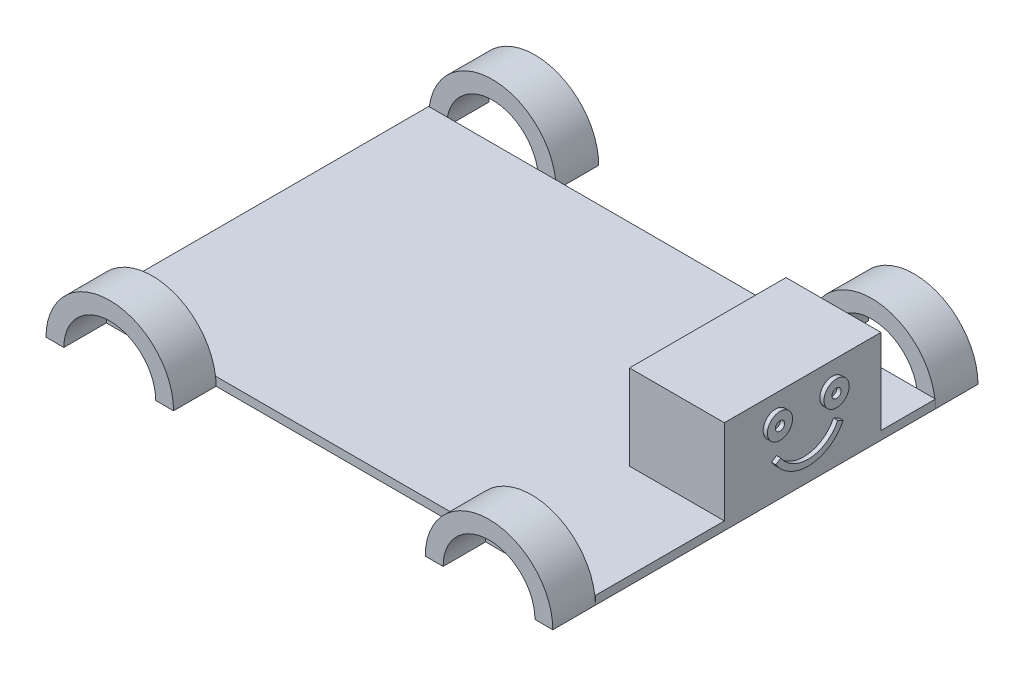
from build123d import *

# Parameters (mm, degrees)
BOSS_EXTRUDE1_DEPTH  = 50
SKETCH2_W            = 150
SKETCH2_H            = 10
BOSS_EXTRUDE2_DEPTH  = 400
SKETCH3_W            = 400
SKETCH3_H            = 10
BOSS_EXTRUDE3_DEPTH  = 446
MIRROR2_COPY_1_DEPTH = 50
SKETCH4_W            = 111.615994823
SKETCH4_H            = 184.082968076
BOSS_EXTRUDE4_DEPTH  = 100
SKETCH5_R            = 14.792808223
SKETCH5_R_2          = 5.397690937
BOSS_EXTRUDE5_DEPTH  = 5


with BuildPart() as part:
    # Sketch1 → Boss-Extrude1 (new body)
    with BuildSketch(Plane.XY):
        with BuildLine():
            ThreePointArc((-54, 0), (0, 54), (54, 0))
            Line((54, 0), (75, 0))
            ThreePointArc((75, 0), (0, 75), (-75, 0))
            Line((-75, 0), (-54, 0))
        make_face()
    boss_extrude1 = extrude(amount=BOSS_EXTRUDE1_DEPTH)

    # Sketch2 → Boss-Extrude2 (add)
    with BuildSketch(Plane(origin=(0, 0, 0), x_dir=(-1, 0, 0), z_dir=(0, 0, -1))):
        with Locations((0, 5)):
            Rectangle(SKETCH2_W, SKETCH2_H)
    extrude(amount=BOSS_EXTRUDE2_DEPTH)

    # Mirror1: Boss-Extrude1 across plane
    add(boss_extrude1.mirror(Plane(origin=(0, 0, -200), x_dir=(1, 0, 0), z_dir=(0, 0, -1))))

    # Sketch3 → Boss-Extrude3 (add)
    with BuildSketch(Plane(origin=(75, 0, 0), x_dir=(0, 0, -1), z_dir=(1, 0, 0))):
        with Locations((200, 5)):
            Rectangle(SKETCH3_W, SKETCH3_H)
    extrude(amount=BOSS_EXTRUDE3_DEPTH)

    # Mirror2: Boss-Extrude1 across plane
    add(boss_extrude1.mirror(Plane.ZY.offset(-223)))

    # Mirror2 copy 1 sketch → Mirror2 copy 1 (add)
    with BuildSketch(Plane(origin=(446, 0, -400), x_dir=(-1, 0, 0), z_dir=(0, 0, -1))):
        with BuildLine():
            ThreePointArc((-54, 0), (0, 54), (54, 0))
            Line((54, 0), (75, 0))
            ThreePointArc((75, 0), (0, 75), (-75, 0))
            Line((-75, 0), (-54, 0))
        make_face()
    extrude(amount=MIRROR2_COPY_1_DEPTH)

    # Sketch4 → Boss-Extrude4 (add)
    with BuildSketch(Plane(origin=(0, 10, 0), x_dir=(1, 0, 0), z_dir=(0, 1, 0))):
        with Locations((465.192002589, 243.791802991)):
            Rectangle(SKETCH4_W, SKETCH4_H)
    extrude(amount=BOSS_EXTRUDE4_DEPTH)

    # Sketch5 → Boss-Extrude5 (add)
    # profile 1 of 3: a face of its own
    with BuildSketch(Plane(origin=(521, 0, 0), x_dir=(0, 0, -1), z_dir=(1, 0, 0))):
        with Locations(Location((212.154840545, 79.041859429, 0), (0, 0, 180))):
            Circle(SKETCH5_R)
        with Locations((212.154840545, 79.041859429)):
            Circle(SKETCH5_R_2, mode=Mode.SUBTRACT)
    # profile 2 of 3: a face of its own
    with BuildSketch(Plane(origin=(521, 0, 0), x_dir=(0, 0, -1), z_dir=(1, 0, 0))):
        with Locations(Location((278.712975673, 79.041859429, 0), (0, 0, 180))):
            Circle(SKETCH5_R)
        with Locations((278.712975673, 79.041859429)):
            Circle(SKETCH5_R_2, mode=Mode.SUBTRACT)
    # profile 3 of 3: a face of its own
    with BuildSketch(Plane(origin=(521, 0, 0), x_dir=(0, 0, -1), z_dir=(1, 0, 0))):
        with BuildLine():
            Line((280.00330423, 50.703730269), (286.391115278, 47.708316048))
            ThreePointArc((286.391115278, 47.708316048), (248.501595961, 21.641542626), (207.227203105, 41.927420598))
            Line((207.227203105, 41.927420598), (213.112092722, 45.819041152))
            ThreePointArc((213.112092722, 45.819041152), (247.987758497, 28.678062178), (280.00330423, 50.703730269))
        make_face()
    extrude(amount=BOSS_EXTRUDE5_DEPTH)


solid = part.part
